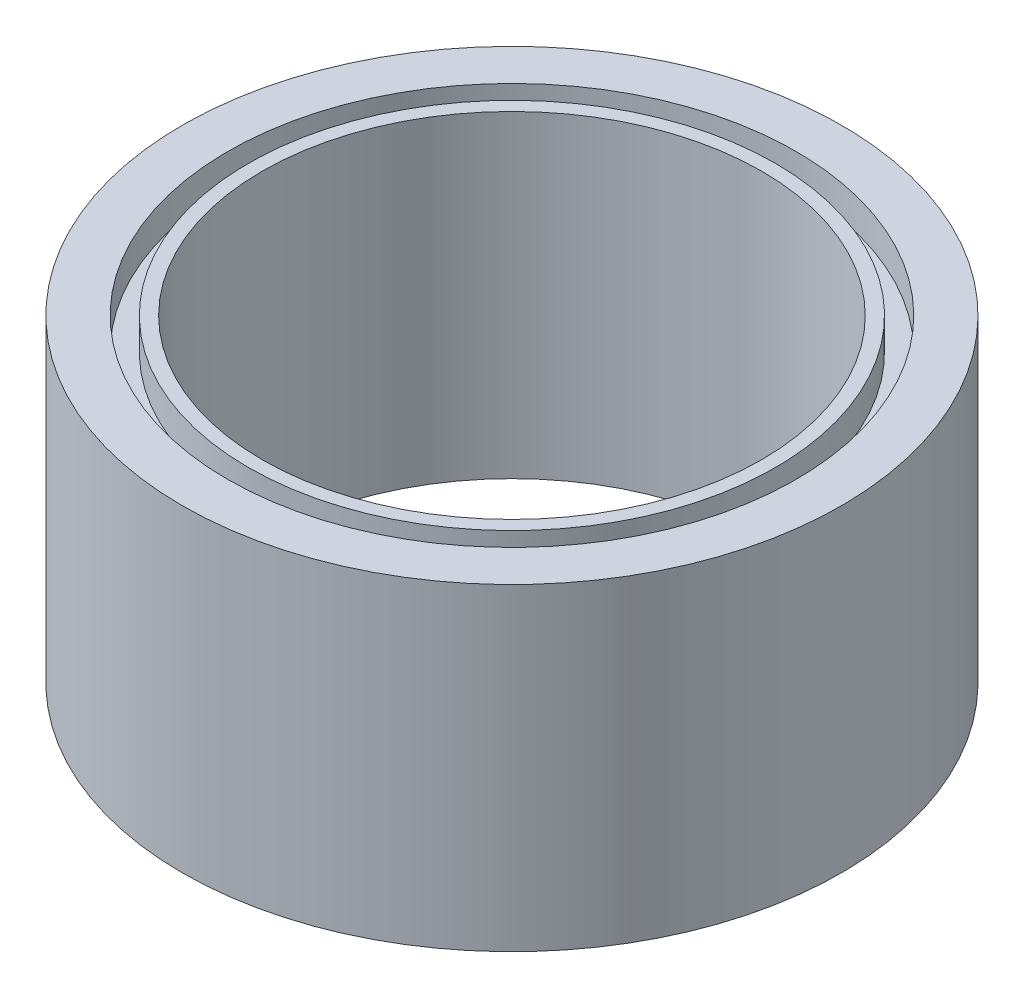
from build123d import *

# Parameters (mm, degrees)
SKETCH_4_R            = 72.55
EXTRUDE_297_DEPTH     = 70
SKETCH_8_R            = 62.55
SKETCH_8_R_2          = 58
CUT_EXTRUDE_406_DEPTH = 7
SKETCH_9_R            = 55
CUT_EXTRUDE_3_DEPTH   = 70


with BuildPart() as part:
    # 草圖4 → Extrude 297 (new body)
    with BuildSketch(Plane(origin=(0, 0, 0), x_dir=(1, 0, 0), z_dir=(0, 1, 0))):
        with Locations(Location((0, 0, 0), (0, 0, 270))):
            Circle(SKETCH_4_R)
    extrude(amount=EXTRUDE_297_DEPTH)

    # 草圖8 → Cut-Extrude 406 (cut)
    with BuildSketch(Plane(origin=(0, 70, 0), x_dir=(1, 0, 0), z_dir=(0, 1, 0))):
        with Locations(Location((0, 0, 0), (0, 0, 270))):
            Circle(SKETCH_8_R)
        with Locations(Location((0, 0, 0), (0, 0, 270))):
            Circle(SKETCH_8_R_2, mode=Mode.SUBTRACT)
    extrude(amount=-CUT_EXTRUDE_406_DEPTH, mode=Mode.SUBTRACT)

    # 草圖9 → 除料-伸長3 (cut)
    with BuildSketch(Plane(origin=(0, 70, 0), x_dir=(1, 0, 0), z_dir=(0, 1, 0))):
        with Locations(Location((0, 0, 0), (0, 0, 270))):
            Circle(SKETCH_9_R)
    extrude(amount=-CUT_EXTRUDE_3_DEPTH, mode=Mode.SUBTRACT)


solid = part.part
